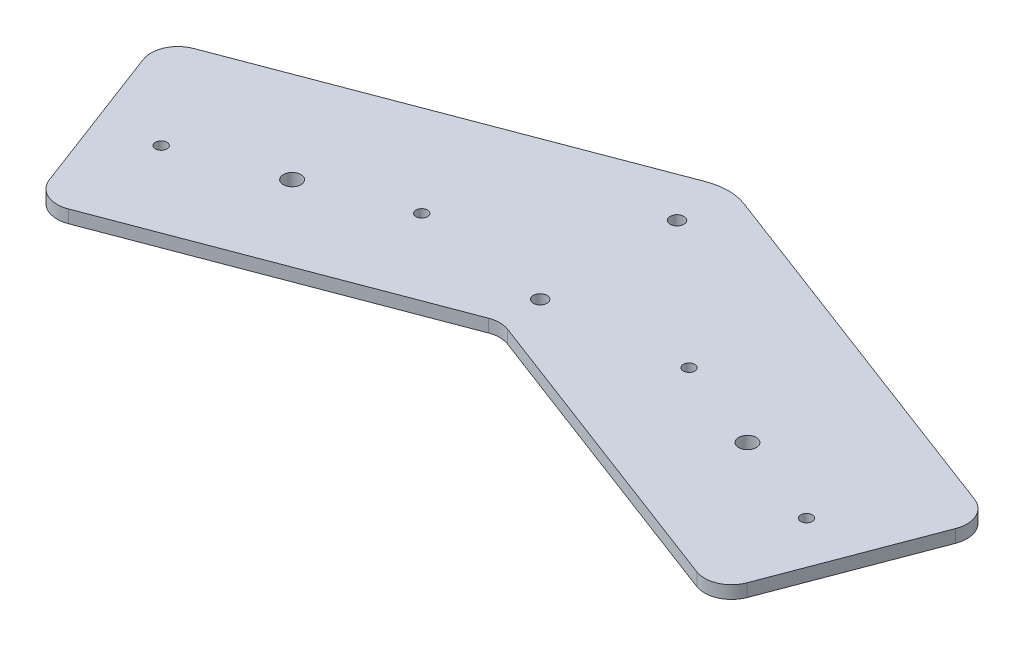
from build123d import *

# Parameters (mm, degrees)
BOSS_EXTRUDE1_DEPTH     = 4.7625
F_1_4_CLEARANCE_HOLE4_D = 6.5278
M4_CLEARANCE_HOLE1_D    = 4.3
F_1_4_20_TAPPED_HOLE1_D = 5.1054


with BuildPart() as part:
    # Sketch2 → Boss-Extrude1 (new body)
    with BuildSketch(Plane(origin=(0, 0, 0), x_dir=(1, 0, 0), z_dir=(0, 1, 0))):
        with BuildLine():
            Line((144.946020413, 76.679156198), (7.085990937, 128.90997287))
            ThreePointArc((7.085990937, 128.90997287), (0.000172842, 130.207283228), (-7.085650583, 128.910001974))
            Line((-7.085650583, 128.910001974), (-144.945894589, 76.679751543))
            ThreePointArc((-144.945894589, 76.679751543), (-150.520615414, 71.435599421), (-150.754362786, 63.785500995))
            Line((-150.754362786, 63.785500995), (-129.497015734, 7.677344758))
            ThreePointArc((-129.497015734, 7.677344758), (-124.252863612, 2.102623932), (-116.602765186, 1.86887656))
            Line((-116.602765186, 1.86887656), (-3.542913137, 44.703157239))
            ThreePointArc((-3.542913137, 44.703157239), (-1.425e-06, 45.351797866), (3.542907623, 44.703142687))
            Line((3.542907623, 44.703142687), (116.602583736, 1.868397631))
            ThreePointArc((116.602583736, 1.868397631), (124.252683122, 2.102113581), (129.496858142, 7.676812867))
            Line((129.496858142, 7.676812867), (150.75443565, 63.784881792))
            ThreePointArc((150.75443565, 63.784881792), (150.520719699, 71.434981178), (144.946020413, 76.679156198))
        make_face()
    extrude(amount=-BOSS_EXTRUDE1_DEPTH)

    # 1/4 Clearance Hole4 (through all)
    with Locations(Plane(origin=(0, 0, 0), x_dir=(1, 0, 0), z_dir=(0, 1, 0))):
        with Locations((84.499786461, 52.795924918), (-84.499851108, 52.795924918)):
            Hole(F_1_4_CLEARANCE_HOLE4_D / 2)

    # M4 Clearance Hole1 (through all)
    with Locations(Plane(origin=(0, 0, 0), x_dir=(1, 0, 0), z_dir=(0, 1, 0))):
        with Locations((-49.61075086, 66.014140629), (-119.745946152, 39.442456816), (49.610666218, 66.014000002), (119.745752362, 39.442028122)):
            Hole(M4_CLEARANCE_HOLE1_D / 2)

    # 1/4-20 Tapped Hole1 (through all)
    with Locations(Plane(origin=(0, 0, 0), x_dir=(1, 0, 0), z_dir=(0, 1, 0))):
        with Locations((-2.901e-06, 111.151797866), (-2.901e-06, 60.351797866)):
            Hole(F_1_4_20_TAPPED_HOLE1_D / 2)


solid = part.part
